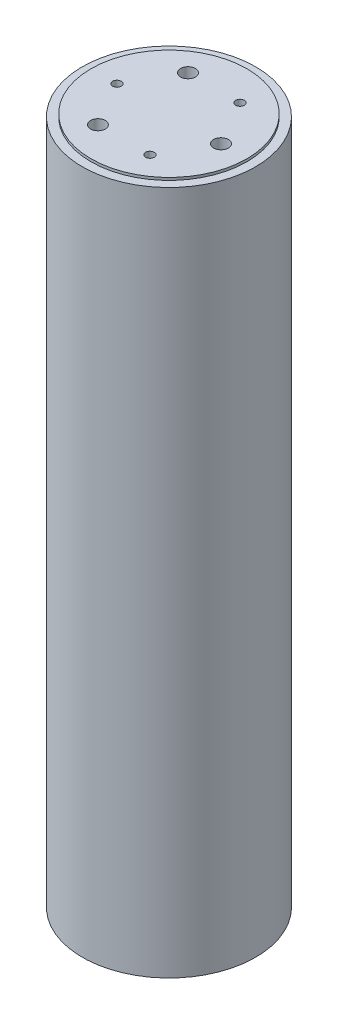
from build123d import *

# Parameters (mm, degrees)
SKETCH_5_R          = 5.7
SKETCH_5_R_2        = 4.28
CUT_EXTRUDE_4_DEPTH = 33
SKETCH_6_R          = 2.5
CUT_EXTRUDE_5_DEPTH = 5
CHAMFER_2_SIZE      = 2.2
EXTRUDE_START       = 1.5
SKETCH_7_R          = 45
EXTRUDE_1_DEPTH     = 1.5
CUT_EXTRUDE_START   = -5
SKETCH_8_R          = 2.5
CUT_EXTRUDE_6_DEPTH = 5
CUT_EXTRUDE_START_2 = -85
SKETCH_9_R          = 4.28
CUT_EXTRUDE_7_DEPTH = 85


with BuildPart() as part:
    # Эскиз2 → Повернуть2 (revolve)
    with BuildSketch(Plane(origin=(0, 0, 0), x_dir=(0, 0, -1), z_dir=(1, 0, 0))):
        Polygon((45, 1.5), (50, 1.5), (50, 396.5), (0, 396.5), (0, 388.5), (48, 388.5), (48, 9.5), (0, 9.5), (0, 0), (45, 0), align=None)
    revolve(axis=Axis((0, 0, 0), (0, 1, 0)))

    # Эскиз5 → Вырез-Вытянуть4 (cut)
    with BuildSketch(Plane.XZ):
        with Locations(Location((0, 0, 0), (0, 0, 270))):
            Circle(SKETCH_5_R)
        with Locations(Location((30, 0, 0), (0, 0, 270))):
            Circle(SKETCH_5_R_2)
    extrude(amount=-CUT_EXTRUDE_4_DEPTH, mode=Mode.SUBTRACT)

    # Эскиз6 → Вырез-Вытянуть5 (cut)
    with BuildSketch(Plane.XZ):
        with Locations(Location((-30, 0, 0), (0, 0, 270))):
            Circle(SKETCH_6_R)
        with Locations(Location((15, 25.980762114, 0), (0, 0, 270))):
            Circle(SKETCH_6_R)
        with Locations(Location((15, -25.980762114, 0), (0, 0, 270))):
            Circle(SKETCH_6_R)
    extrude(amount=-CUT_EXTRUDE_5_DEPTH, mode=Mode.SUBTRACT)

    # Фаска2
    chamfer_2_edges = [part.edges().sort_by_distance(p)[0] for p in [
        (0, 0, 5.7),
    ]]
    chamfer(chamfer_2_edges, length=CHAMFER_2_SIZE)

    # Эскиз7 → Бобышка-Вытянуть1 (add)
    with BuildSketch(Plane(origin=(0, 396.5, 0), x_dir=(1, 0, 0), z_dir=(0, 1, 0)).offset(EXTRUDE_START)):
        with Locations(Location((0, 0, 0), (0, 0, 90))):
            Circle(SKETCH_7_R)
    extrude(amount=-EXTRUDE_1_DEPTH)

    # Эскиз8 → Вырез-Вытянуть6 (cut)
    with BuildSketch(Plane(origin=(0, 398, 0), x_dir=(1, 0, 0), z_dir=(0, 1, 0)).offset(CUT_EXTRUDE_START)):
        with Locations(Location((-30, 0, 0), (0, 0, 90))):
            Circle(SKETCH_8_R)
        with Locations(Location((15, 25.980762114, 0), (0, 0, 90))):
            Circle(SKETCH_8_R)
        with Locations(Location((15, -25.980762114, 0), (0, 0, 90))):
            Circle(SKETCH_8_R)
    extrude(amount=CUT_EXTRUDE_6_DEPTH, mode=Mode.SUBTRACT)

    # Эскиз9 → Вырез-Вытянуть7 (cut)
    with BuildSketch(Plane(origin=(0, 398, 0), x_dir=(1, 0, 0), z_dir=(0, 1, 0)).offset(CUT_EXTRUDE_START_2)):
        with Locations(Location((30, 0, 0), (0, 0, 90))):
            Circle(SKETCH_9_R)
        with Locations(Location((-15, -25.980762114, 0), (0, 0, 270))):
            Circle(SKETCH_9_R)
        with Locations(Location((-15, 25.980762114, 0), (0, 0, 270))):
            Circle(SKETCH_9_R)
    extrude(amount=CUT_EXTRUDE_7_DEPTH, mode=Mode.SUBTRACT)


solid = part.part
